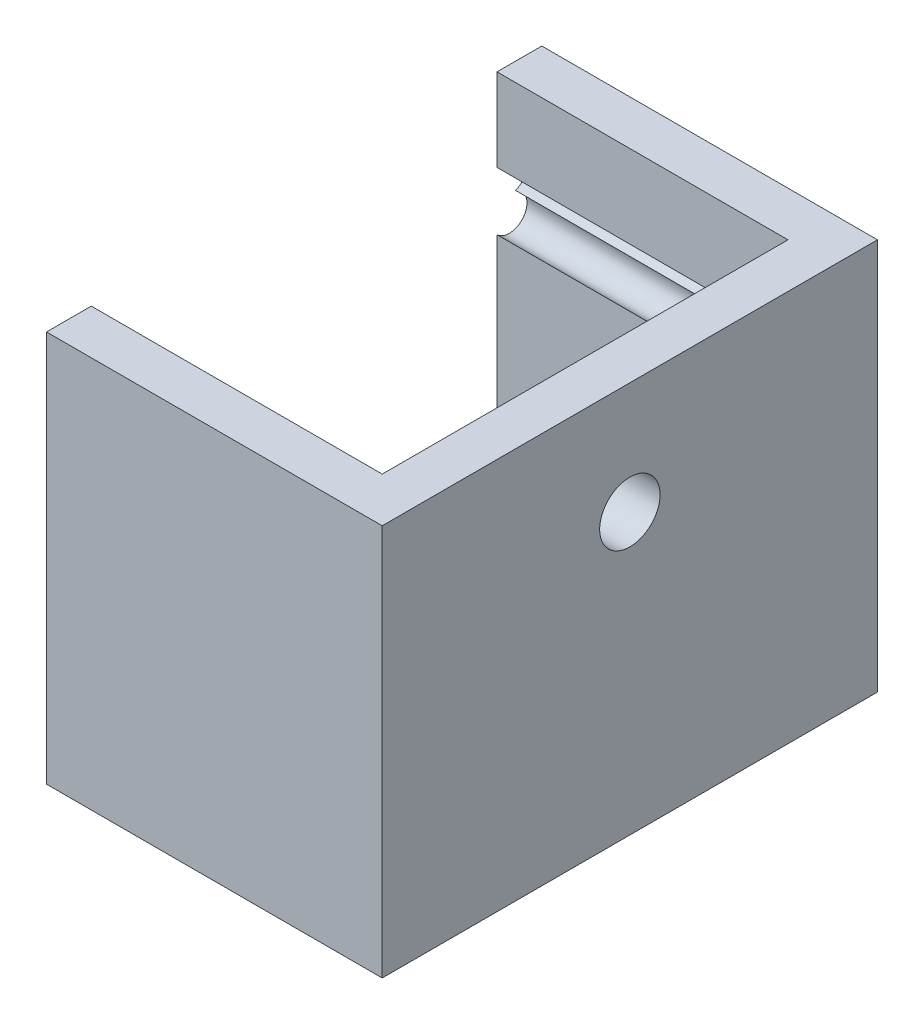
from build123d import *

# Parameters (mm, degrees)
SKETCH1_W               = 30
SKETCH1_H               = 35
BOSS_EXTRUDE1_DEPTH     = 44.26
SKETCH2_W               = 26
SKETCH2_H               = 36.26
CUT_EXTRUDE1_DEPTH      = 31
CUT_EXTRUDE2_DEPTH      = 26
CUT_EXTRUDE3_DEPTH      = 64.905771257
CUT_EXTRUDE3_DEPTH_BACK = 64.905771257
SKETCH4_R               = 2.7
CUT_EXTRUDE7_DEPTH      = 62.805724654
CUT_EXTRUDE7_DEPTH_BACK = 62.805724654
SKETCH6_R               = 1.65


with BuildPart() as part:
    # Sketch1 → Boss-Extrude1 (new body)
    with BuildSketch(Plane.XY):
        with Locations((-15, 17.5)):
            Rectangle(SKETCH1_W, SKETCH1_H)
    extrude(amount=BOSS_EXTRUDE1_DEPTH)

    # Sketch2 → Cut-Extrude1 (cut)
    with BuildSketch(Plane(origin=(0, 35, 0), x_dir=(1, 0, 0), z_dir=(0, 1, 0))):
        with Locations((-17, -22.13)):
            Rectangle(SKETCH2_W, SKETCH2_H)
    extrude(amount=-CUT_EXTRUDE1_DEPTH, mode=Mode.SUBTRACT)

    # Sketch3 → Cut-Extrude2 (cut)
    with BuildSketch(Plane.ZY.offset(30)):
        with BuildLine():
            Line((4, 27.602220032), (4, 22.397779968))
            ThreePointArc((4, 22.397779968), (1.570379812, 22.680763567), (2.347731949, 25))
            ThreePointArc((2.347731949, 25), (1.570379812, 27.319236433), (4, 27.602220032))
        make_face()
        with BuildLine():
            Line((40.26, 27.602220032), (40.26, 22.397779968))
            ThreePointArc((40.26, 22.397779968), (42.689620188, 22.680763567), (41.912268051, 25))
            ThreePointArc((41.912268051, 25), (42.689620188, 27.319236433), (40.26, 27.602220032))
        make_face()
    extrude(amount=-CUT_EXTRUDE2_DEPTH, mode=Mode.SUBTRACT)

    # Sketch4 → Cut-Extrude3 (cut, two sides: drawn at the far end of the back side and taken through both)
    with BuildSketch(Plane(origin=(0, 0, 0), x_dir=(0, 0, -1), z_dir=(1, 0, 0)).offset(-CUT_EXTRUDE3_DEPTH_BACK)):
        with Locations(Location((-22.13, 25, 0), (0, 0, 90))):
            Circle(SKETCH4_R)
    extrude(amount=CUT_EXTRUDE3_DEPTH + CUT_EXTRUDE3_DEPTH_BACK, mode=Mode.SUBTRACT)

    # Sketch6 → Cut-Extrude7 (cut, two sides: drawn at the far end of the back side and taken through both)
    with BuildSketch(Plane(origin=(0, 4, 0), x_dir=(1, 0, 0), z_dir=(0, 1, 0)).offset(-CUT_EXTRUDE7_DEPTH_BACK)):
        with Locations(Location((-24, -34.26, 0), (0, 0, 180))):
            Circle(SKETCH6_R)
        with Locations(Location((-12, -34.26, 0), (0, 0, 180))):
            Circle(SKETCH6_R)
        with Locations((-12, -14.26)):
            Circle(SKETCH6_R)
        with Locations((-24, -14.26)):
            Circle(SKETCH6_R)
    extrude(amount=CUT_EXTRUDE7_DEPTH + CUT_EXTRUDE7_DEPTH_BACK, mode=Mode.SUBTRACT)


solid = part.part
